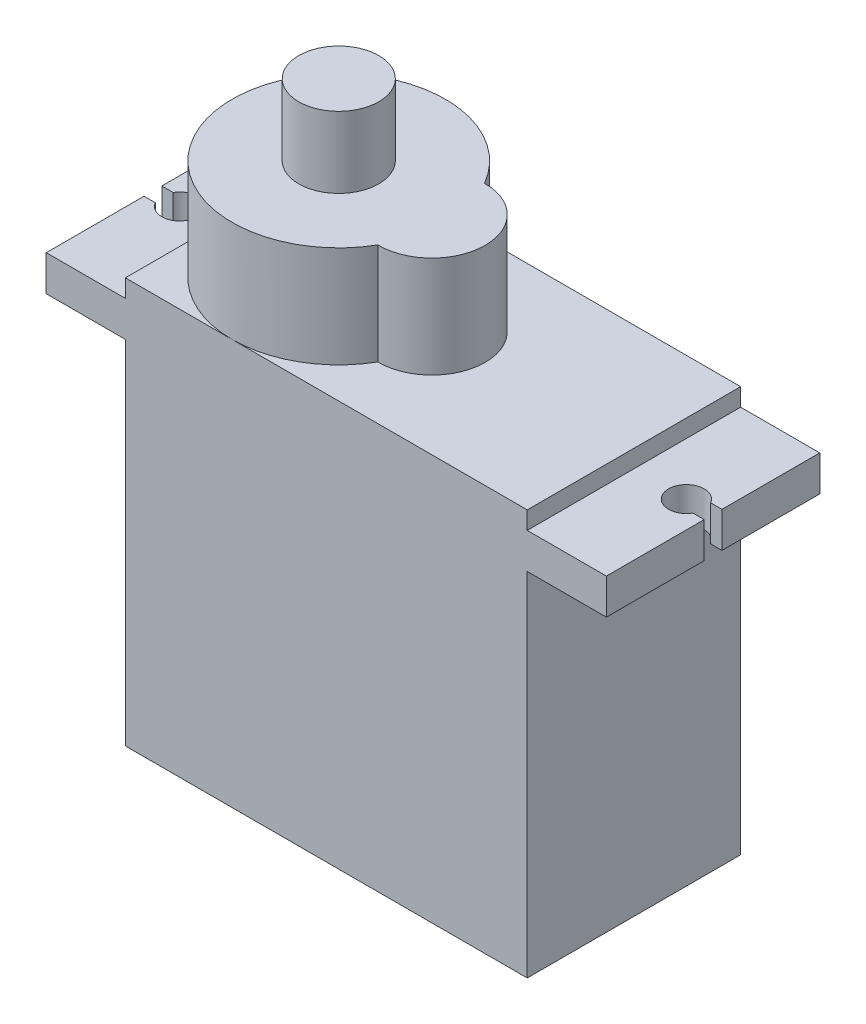
from build123d import *

# Parameters (mm, degrees)
SCHIZZO1_W                   = 22.6
SCHIZZO1_H                   = 12
ESTRUSIONE_ESTRUSIONE1_DEPTH = 19.8
SCHIZZO3_W                   = 31.5
SCHIZZO3_H                   = 12
ESTRUSIONE_ESTRUSIONE2_DEPTH = 2
SCHIZZO4_W                   = 22.6
SCHIZZO4_H                   = 12
ESTRUSIONE_ESTRUSIONE3_DEPTH = 1
SCHIZZO5_R                   = 3
SCHIZZO5_R_2                 = 6
ESTRUSIONE_ESTRUSIONE4_DEPTH = 5.7
SCHIZZO6_R                   = 2.25
ESTRUSIONE_ESTRUSIONE5_DEPTH = 4
TAGLIO_ESTRUSIONE2_REACH     = 38.755


with BuildPart() as part:
    # Schizzo1 → Estrusione-Estrusione1 (new body)
    with BuildSketch(Plane(origin=(0, 0, 0), x_dir=(1, 0, 0), z_dir=(0, 1, 0))):
        with Locations((11.3, 6)):
            Rectangle(SCHIZZO1_W, SCHIZZO1_H)
    extrude(amount=ESTRUSIONE_ESTRUSIONE1_DEPTH)

    # Schizzo3 → Estrusione-Estrusione2 (add)
    with BuildSketch(Plane(origin=(0, 19.8, 0), x_dir=(1, 0, 0), z_dir=(0, 1, 0))):
        with Locations((11.3, 6)):
            Rectangle(SCHIZZO3_W, SCHIZZO3_H)
    extrude(amount=ESTRUSIONE_ESTRUSIONE2_DEPTH)

    # Schizzo4 → Estrusione-Estrusione3 (add)
    with BuildSketch(Plane(origin=(0, 21.8, 0), x_dir=(1, 0, 0), z_dir=(0, 1, 0))):
        with Locations((11.3, 6)):
            Rectangle(SCHIZZO4_W, SCHIZZO4_H)
    extrude(amount=ESTRUSIONE_ESTRUSIONE3_DEPTH)

    # Schizzo5 → Estrusione-Estrusione4 (add)
    with BuildSketch(Plane(origin=(0, 22.8, 0), x_dir=(1, 0, 0), z_dir=(0, 1, 0))):
        with Locations((11.236395356, 6)):
            Circle(SCHIZZO5_R)
        with Locations((6, 6)):
            Circle(SCHIZZO5_R_2)
    extrude(amount=ESTRUSIONE_ESTRUSIONE4_DEPTH)

    # Schizzo6 → Estrusione-Estrusione5 (add)
    with BuildSketch(Plane(origin=(0, 28.5, 0), x_dir=(1, 0, 0), z_dir=(0, 1, 0))):
        with Locations(Location((6, 6, 0), (0, 0, 270))):
            Circle(SCHIZZO6_R)
    extrude(amount=ESTRUSIONE_ESTRUSIONE5_DEPTH)

    # Schizzo7 → Taglio-Estrusione2 (cut, up to next)
    with BuildSketch(Plane(origin=(0, 21.8, 0), x_dir=(1, 0, 0), z_dir=(0, 1, 0)), mode=Mode.PRIVATE) as taglio_estrusione2_sk1:
        with BuildLine():
            Line((-4.45, 5.5), (-3.816025404, 5.5))
            ThreePointArc((-3.816025404, 5.5), (-3.915925826, 5.741180955), (-3.95, 6))
            Line((-3.95, 6), (-4.45, 6))
            Line((-4.45, 6), (-4.45, 5.5))
        make_face()
    taglio_estrusione2_tool1 = extrude(taglio_estrusione2_sk1.sketch, amount=-TAGLIO_ESTRUSIONE2_REACH, mode=Mode.PRIVATE) & part.part
    # Schizzo7 → Taglio-Estrusione2 (cut, up to next)
    with BuildSketch(Plane(origin=(0, 21.8, 0), x_dir=(1, 0, 0), z_dir=(0, 1, 0)), mode=Mode.PRIVATE) as taglio_estrusione2_sk2:
        with BuildLine():
            ThreePointArc((-3.95, 6), (-3.915925826, 6.258819045), (-3.816025404, 6.5))
            Line((-3.816025404, 6.5), (-4.45, 6.5))
            Line((-4.45, 6.5), (-4.45, 6))
            Line((-4.45, 6), (-3.95, 6))
        make_face()
    taglio_estrusione2_tool2 = extrude(taglio_estrusione2_sk2.sketch, amount=-TAGLIO_ESTRUSIONE2_REACH, mode=Mode.PRIVATE) & part.part
    # Schizzo7 → Taglio-Estrusione2 (cut, up to next)
    with BuildSketch(Plane(origin=(0, 21.8, 0), x_dir=(1, 0, 0), z_dir=(0, 1, 0)), mode=Mode.PRIVATE) as taglio_estrusione2_sk3:
        with BuildLine():
            ThreePointArc((-3.816025404, 5.5), (-2.691180955, 5.034074174), (-1.95, 6))
            Line((-1.95, 6), (-2.449082486, 6))
            Line((-2.449082486, 6), (-2.449082486, 5.5))
            Line((-2.449082486, 5.5), (-3.816025404, 5.5))
        make_face()
    taglio_estrusione2_tool3 = extrude(taglio_estrusione2_sk3.sketch, amount=-TAGLIO_ESTRUSIONE2_REACH, mode=Mode.PRIVATE) & part.part
    # Schizzo7 → Taglio-Estrusione2 (cut, up to next)
    with BuildSketch(Plane(origin=(0, 21.8, 0), x_dir=(1, 0, 0), z_dir=(0, 1, 0)), mode=Mode.PRIVATE) as taglio_estrusione2_sk4:
        with BuildLine():
            Line((-2.449082486, 5.5), (-2.449082486, 6))
            Line((-2.449082486, 6), (-3.95, 6))
            ThreePointArc((-3.95, 6), (-3.915925826, 5.741180955), (-3.816025404, 5.5))
            Line((-3.816025404, 5.5), (-2.449082486, 5.5))
        make_face()
    taglio_estrusione2_tool4 = extrude(taglio_estrusione2_sk4.sketch, amount=-TAGLIO_ESTRUSIONE2_REACH, mode=Mode.PRIVATE) & part.part
    # Schizzo7 → Taglio-Estrusione2 (cut, up to next)
    with BuildSketch(Plane(origin=(0, 21.8, 0), x_dir=(1, 0, 0), z_dir=(0, 1, 0)), mode=Mode.PRIVATE) as taglio_estrusione2_sk5:
        with BuildLine():
            Line((-2.449082486, 6), (-1.95, 6))
            ThreePointArc((-1.95, 6), (-2.691180955, 6.965925826), (-3.816025404, 6.5))
            Line((-3.816025404, 6.5), (-2.449082486, 6.5))
            Line((-2.449082486, 6.5), (-2.449082486, 6))
        make_face()
    taglio_estrusione2_tool5 = extrude(taglio_estrusione2_sk5.sketch, amount=-TAGLIO_ESTRUSIONE2_REACH, mode=Mode.PRIVATE) & part.part
    # Schizzo7 → Taglio-Estrusione2 (cut, up to next)
    with BuildSketch(Plane(origin=(0, 21.8, 0), x_dir=(1, 0, 0), z_dir=(0, 1, 0)), mode=Mode.PRIVATE) as taglio_estrusione2_sk6:
        with BuildLine():
            Line((-3.95, 6), (-2.449082486, 6))
            Line((-2.449082486, 6), (-2.449082486, 6.5))
            Line((-2.449082486, 6.5), (-3.816025404, 6.5))
            ThreePointArc((-3.816025404, 6.5), (-3.915925826, 6.258819045), (-3.95, 6))
        make_face()
    taglio_estrusione2_tool6 = extrude(taglio_estrusione2_sk6.sketch, amount=-TAGLIO_ESTRUSIONE2_REACH, mode=Mode.PRIVATE) & part.part
    # Schizzo7 → Taglio-Estrusione2 (cut, up to next)
    with BuildSketch(Plane(origin=(0, 21.8, 0), x_dir=(1, 0, 0), z_dir=(0, 1, 0)), mode=Mode.PRIVATE) as taglio_estrusione2_sk7:
        with BuildLine():
            ThreePointArc((-3.816025404, 5.5), (-2.691180955, 5.034074174), (-1.95, 6))
            Line((-1.95, 6), (-2.449082486, 6))
            Line((-2.449082486, 6), (-2.449082486, 5.5))
            Line((-2.449082486, 5.5), (-3.816025404, 5.5))
        make_face()
    taglio_estrusione2_tool7 = extrude(taglio_estrusione2_sk7.sketch, amount=-TAGLIO_ESTRUSIONE2_REACH, mode=Mode.PRIVATE) & part.part
    # Schizzo7 → Taglio-Estrusione2 (cut, up to next)
    with BuildSketch(Plane(origin=(0, 21.8, 0), x_dir=(1, 0, 0), z_dir=(0, 1, 0)), mode=Mode.PRIVATE) as taglio_estrusione2_sk8:
        with BuildLine():
            Line((-2.449082486, 5.5), (-2.449082486, 6))
            Line((-2.449082486, 6), (-3.95, 6))
            ThreePointArc((-3.95, 6), (-3.915925826, 5.741180955), (-3.816025404, 5.5))
            Line((-3.816025404, 5.5), (-2.449082486, 5.5))
        make_face()
    taglio_estrusione2_tool8 = extrude(taglio_estrusione2_sk8.sketch, amount=-TAGLIO_ESTRUSIONE2_REACH, mode=Mode.PRIVATE) & part.part
    # Schizzo7 → Taglio-Estrusione2 (cut, up to next)
    with BuildSketch(Plane(origin=(0, 21.8, 0), x_dir=(1, 0, 0), z_dir=(0, 1, 0)), mode=Mode.PRIVATE) as taglio_estrusione2_sk9:
        with BuildLine():
            Line((-2.449082486, 6), (-1.95, 6))
            ThreePointArc((-1.95, 6), (-2.691180955, 6.965925826), (-3.816025404, 6.5))
            Line((-3.816025404, 6.5), (-2.449082486, 6.5))
            Line((-2.449082486, 6.5), (-2.449082486, 6))
        make_face()
    taglio_estrusione2_tool9 = extrude(taglio_estrusione2_sk9.sketch, amount=-TAGLIO_ESTRUSIONE2_REACH, mode=Mode.PRIVATE) & part.part
    # Schizzo7 → Taglio-Estrusione2 (cut, up to next)
    with BuildSketch(Plane(origin=(0, 21.8, 0), x_dir=(1, 0, 0), z_dir=(0, 1, 0)), mode=Mode.PRIVATE) as taglio_estrusione2_sk10:
        with BuildLine():
            Line((-3.95, 6), (-2.449082486, 6))
            Line((-2.449082486, 6), (-2.449082486, 6.5))
            Line((-2.449082486, 6.5), (-3.816025404, 6.5))
            ThreePointArc((-3.816025404, 6.5), (-3.915925826, 6.258819045), (-3.95, 6))
        make_face()
    taglio_estrusione2_tool10 = extrude(taglio_estrusione2_sk10.sketch, amount=-TAGLIO_ESTRUSIONE2_REACH, mode=Mode.PRIVATE) & part.part
    # Schizzo7 → Taglio-Estrusione2 (cut, up to next)
    with BuildSketch(Plane(origin=(0, 21.8, 0), x_dir=(1, 0, 0), z_dir=(0, 1, 0)), mode=Mode.PRIVATE) as taglio_estrusione2_sk11:
        with BuildLine():
            ThreePointArc((26.416025404, 5.5), (26.515925826, 5.741180955), (26.55, 6))
            Line((26.55, 6), (25.047557224, 6))
            Line((25.047557224, 6), (25.047557224, 5.5))
            Line((25.047557224, 5.5), (26.416025404, 5.5))
        make_face()
    taglio_estrusione2_tool11 = extrude(taglio_estrusione2_sk11.sketch, amount=-TAGLIO_ESTRUSIONE2_REACH, mode=Mode.PRIVATE) & part.part
    # Schizzo7 → Taglio-Estrusione2 (cut, up to next)
    with BuildSketch(Plane(origin=(0, 21.8, 0), x_dir=(1, 0, 0), z_dir=(0, 1, 0)), mode=Mode.PRIVATE) as taglio_estrusione2_sk12:
        with BuildLine():
            Line((25.047557224, 5.5), (25.047557224, 6))
            Line((25.047557224, 6), (24.55, 6))
            ThreePointArc((24.55, 6), (25.291180955, 5.034074174), (26.416025404, 5.5))
            Line((26.416025404, 5.5), (25.047557224, 5.5))
        make_face()
    taglio_estrusione2_tool12 = extrude(taglio_estrusione2_sk12.sketch, amount=-TAGLIO_ESTRUSIONE2_REACH, mode=Mode.PRIVATE) & part.part
    # Schizzo7 → Taglio-Estrusione2 (cut, up to next)
    with BuildSketch(Plane(origin=(0, 21.8, 0), x_dir=(1, 0, 0), z_dir=(0, 1, 0)), mode=Mode.PRIVATE) as taglio_estrusione2_sk13:
        with BuildLine():
            ThreePointArc((26.416025404, 5.5), (26.515925826, 5.741180955), (26.55, 6))
            Line((26.55, 6), (25.047557224, 6))
            Line((25.047557224, 6), (25.047557224, 5.5))
            Line((25.047557224, 5.5), (26.416025404, 5.5))
        make_face()
    taglio_estrusione2_tool13 = extrude(taglio_estrusione2_sk13.sketch, amount=-TAGLIO_ESTRUSIONE2_REACH, mode=Mode.PRIVATE) & part.part
    # Schizzo7 → Taglio-Estrusione2 (cut, up to next)
    with BuildSketch(Plane(origin=(0, 21.8, 0), x_dir=(1, 0, 0), z_dir=(0, 1, 0)), mode=Mode.PRIVATE) as taglio_estrusione2_sk14:
        with BuildLine():
            Line((25.047557224, 5.5), (25.047557224, 6))
            Line((25.047557224, 6), (24.55, 6))
            ThreePointArc((24.55, 6), (25.291180955, 5.034074174), (26.416025404, 5.5))
            Line((26.416025404, 5.5), (25.047557224, 5.5))
        make_face()
    taglio_estrusione2_tool14 = extrude(taglio_estrusione2_sk14.sketch, amount=-TAGLIO_ESTRUSIONE2_REACH, mode=Mode.PRIVATE) & part.part
    # Schizzo7 → Taglio-Estrusione2 (cut, up to next)
    with BuildSketch(Plane(origin=(0, 21.8, 0), x_dir=(1, 0, 0), z_dir=(0, 1, 0)), mode=Mode.PRIVATE) as taglio_estrusione2_sk15:
        with BuildLine():
            Line((25.047557224, 6), (26.55, 6))
            ThreePointArc((26.55, 6), (26.515925826, 6.258819045), (26.416025404, 6.5))
            Line((26.416025404, 6.5), (25.047557224, 6.5))
            Line((25.047557224, 6.5), (25.047557224, 6))
        make_face()
    taglio_estrusione2_tool15 = extrude(taglio_estrusione2_sk15.sketch, amount=-TAGLIO_ESTRUSIONE2_REACH, mode=Mode.PRIVATE) & part.part
    # Schizzo7 → Taglio-Estrusione2 (cut, up to next)
    with BuildSketch(Plane(origin=(0, 21.8, 0), x_dir=(1, 0, 0), z_dir=(0, 1, 0)), mode=Mode.PRIVATE) as taglio_estrusione2_sk16:
        with BuildLine():
            Line((24.55, 6), (25.047557224, 6))
            Line((25.047557224, 6), (25.047557224, 6.5))
            Line((25.047557224, 6.5), (26.416025404, 6.5))
            ThreePointArc((26.416025404, 6.5), (25.291180955, 6.965925826), (24.55, 6))
        make_face()
    taglio_estrusione2_tool16 = extrude(taglio_estrusione2_sk16.sketch, amount=-TAGLIO_ESTRUSIONE2_REACH, mode=Mode.PRIVATE) & part.part
    # Schizzo7 → Taglio-Estrusione2 (cut, up to next)
    with BuildSketch(Plane(origin=(0, 21.8, 0), x_dir=(1, 0, 0), z_dir=(0, 1, 0)), mode=Mode.PRIVATE) as taglio_estrusione2_sk17:
        with BuildLine():
            Line((25.047557224, 6), (26.55, 6))
            ThreePointArc((26.55, 6), (26.515925826, 6.258819045), (26.416025404, 6.5))
            Line((26.416025404, 6.5), (25.047557224, 6.5))
            Line((25.047557224, 6.5), (25.047557224, 6))
        make_face()
    taglio_estrusione2_tool17 = extrude(taglio_estrusione2_sk17.sketch, amount=-TAGLIO_ESTRUSIONE2_REACH, mode=Mode.PRIVATE) & part.part
    # Schizzo7 → Taglio-Estrusione2 (cut, up to next)
    with BuildSketch(Plane(origin=(0, 21.8, 0), x_dir=(1, 0, 0), z_dir=(0, 1, 0)), mode=Mode.PRIVATE) as taglio_estrusione2_sk18:
        with BuildLine():
            Line((24.55, 6), (25.047557224, 6))
            Line((25.047557224, 6), (25.047557224, 6.5))
            Line((25.047557224, 6.5), (26.416025404, 6.5))
            ThreePointArc((26.416025404, 6.5), (25.291180955, 6.965925826), (24.55, 6))
        make_face()
    taglio_estrusione2_tool18 = extrude(taglio_estrusione2_sk18.sketch, amount=-TAGLIO_ESTRUSIONE2_REACH, mode=Mode.PRIVATE) & part.part
    # Schizzo7 → Taglio-Estrusione2 (cut, up to next)
    with BuildSketch(Plane(origin=(0, 21.8, 0), x_dir=(1, 0, 0), z_dir=(0, 1, 0)), mode=Mode.PRIVATE) as taglio_estrusione2_sk19:
        with BuildLine():
            Line((26.55, 6), (27.05, 6))
            Line((27.05, 6), (27.05, 6.5))
            Line((27.05, 6.5), (26.416025404, 6.5))
            ThreePointArc((26.416025404, 6.5), (26.515925826, 6.258819045), (26.55, 6))
        make_face()
    taglio_estrusione2_tool19 = extrude(taglio_estrusione2_sk19.sketch, amount=-TAGLIO_ESTRUSIONE2_REACH, mode=Mode.PRIVATE) & part.part
    # Schizzo7 → Taglio-Estrusione2 (cut, up to next)
    with BuildSketch(Plane(origin=(0, 21.8, 0), x_dir=(1, 0, 0), z_dir=(0, 1, 0)), mode=Mode.PRIVATE) as taglio_estrusione2_sk20:
        with BuildLine():
            Line((27.05, 5.5), (27.05, 6))
            Line((27.05, 6), (26.55, 6))
            ThreePointArc((26.55, 6), (26.515925826, 5.741180955), (26.416025404, 5.5))
            Line((26.416025404, 5.5), (27.05, 5.5))
        make_face()
    taglio_estrusione2_tool20 = extrude(taglio_estrusione2_sk20.sketch, amount=-TAGLIO_ESTRUSIONE2_REACH, mode=Mode.PRIVATE) & part.part
    add(taglio_estrusione2_tool1.solids().sort_by_distance((-4.176869, 21.8, -5.73988))[0], mode=Mode.SUBTRACT)
    add(taglio_estrusione2_tool2.solids().sort_by_distance((-4.176869, 21.8, -6.26012))[0], mode=Mode.SUBTRACT)
    add(taglio_estrusione2_tool3.solids().sort_by_distance((-2.752339, 21.8, -5.42137))[0], mode=Mode.SUBTRACT)
    add(taglio_estrusione2_tool4.solids().sort_by_distance((-3.178383, 21.8, -5.753773))[0], mode=Mode.SUBTRACT)
    add(taglio_estrusione2_tool5.solids().sort_by_distance((-2.752339, 21.8, -6.57863))[0], mode=Mode.SUBTRACT)
    add(taglio_estrusione2_tool6.solids().sort_by_distance((-3.178383, 21.8, -6.246227))[0], mode=Mode.SUBTRACT)
    add(taglio_estrusione2_tool7.solids().sort_by_distance((-2.752339, 21.8, -5.42137))[0], mode=Mode.SUBTRACT)
    add(taglio_estrusione2_tool8.solids().sort_by_distance((-3.178383, 21.8, -5.753773))[0], mode=Mode.SUBTRACT)
    add(taglio_estrusione2_tool9.solids().sort_by_distance((-2.752339, 21.8, -6.57863))[0], mode=Mode.SUBTRACT)
    add(taglio_estrusione2_tool10.solids().sort_by_distance((-3.178383, 21.8, -6.246227))[0], mode=Mode.SUBTRACT)
    add(taglio_estrusione2_tool11.solids().sort_by_distance((25.777619, 21.8, -5.753769))[0], mode=Mode.SUBTRACT)
    add(taglio_estrusione2_tool12.solids().sort_by_distance((25.352614, 21.8, -5.421072))[0], mode=Mode.SUBTRACT)
    add(taglio_estrusione2_tool13.solids().sort_by_distance((25.777619, 21.8, -5.753769))[0], mode=Mode.SUBTRACT)
    add(taglio_estrusione2_tool14.solids().sort_by_distance((25.352614, 21.8, -5.421072))[0], mode=Mode.SUBTRACT)
    add(taglio_estrusione2_tool15.solids().sort_by_distance((25.777619, 21.8, -6.246231))[0], mode=Mode.SUBTRACT)
    add(taglio_estrusione2_tool16.solids().sort_by_distance((25.352614, 21.8, -6.578928))[0], mode=Mode.SUBTRACT)
    add(taglio_estrusione2_tool17.solids().sort_by_distance((25.777619, 21.8, -6.246231))[0], mode=Mode.SUBTRACT)
    add(taglio_estrusione2_tool18.solids().sort_by_distance((25.352614, 21.8, -6.578928))[0], mode=Mode.SUBTRACT)
    add(taglio_estrusione2_tool19.solids().sort_by_distance((26.776869, 21.8, -6.26012))[0], mode=Mode.SUBTRACT)
    add(taglio_estrusione2_tool20.solids().sort_by_distance((26.776869, 21.8, -5.73988))[0], mode=Mode.SUBTRACT)


solid = part.part
